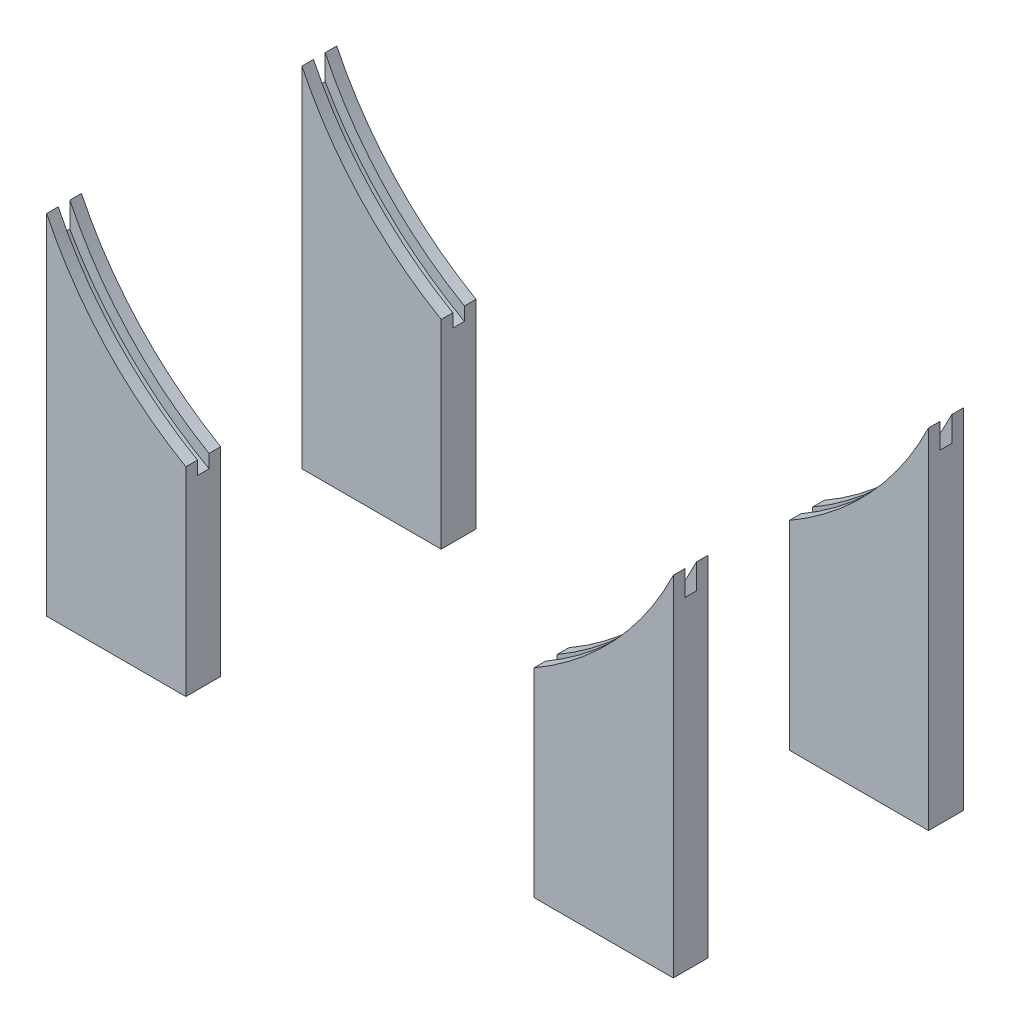
from build123d import *

# Parameters (mm, degrees)
BOSS_EXTRUDE4_DEPTH = 2.5
BOSS_EXTRUDE5_DEPTH = 5


with BuildPart() as part:
    # Sketch7 → Boss-Extrude4 (new, symmetric)
    with BuildSketch(Plane.XY.offset(2.5)):
        with BuildLine():
            Line((75, -135.646599663), (75, -215.646599663))
            Line((75, -215.646599663), (135, -215.646599663))
            Line((135, -215.646599663), (135, -76.157731059))
            ThreePointArc((135, -76.157731059), (109.131715701, -110.069380974), (75, -135.646599663))
        make_face()
    extrude(amount=BOSS_EXTRUDE4_DEPTH, both=True)

    # Sketch8 → Boss-Extrude5 (add)
    with BuildSketch(Plane.XY.offset(5)):
        with BuildLine():
            Line((75, -215.646599663), (135, -215.646599663))
            Line((135, -215.646599663), (135, -65.383484153))
            ThreePointArc((135, -65.383484153), (109.84406279, -102.148332683), (75, -129.903810568))
            Line((75, -129.903810568), (75, -215.646599663))
        make_face()
    boss_extrude5 = extrude(amount=BOSS_EXTRUDE5_DEPTH)

    # Mirror1: Boss-Extrude5 across plane
    add(boss_extrude5.mirror(Plane.XY.offset(2.5)))


with BuildPart() as body_2:
    # Mirror2: mirrored copy
    add(part.part.mirror(Plane(origin=(0, 0, 0), x_dir=(0, 0, 1), z_dir=(1, 0, 0))))


with BuildPart() as body_3:
    # Mirror3: mirrored copy
    add(part.part.mirror(Plane.XY.offset(57.5)))


with BuildPart() as body_4:
    # Mirror3 2: mirrored copy
    add(body_2.part.mirror(Plane.XY.offset(57.5)))


solid = Compound([part.part, body_2.part, body_3.part, body_4.part])
